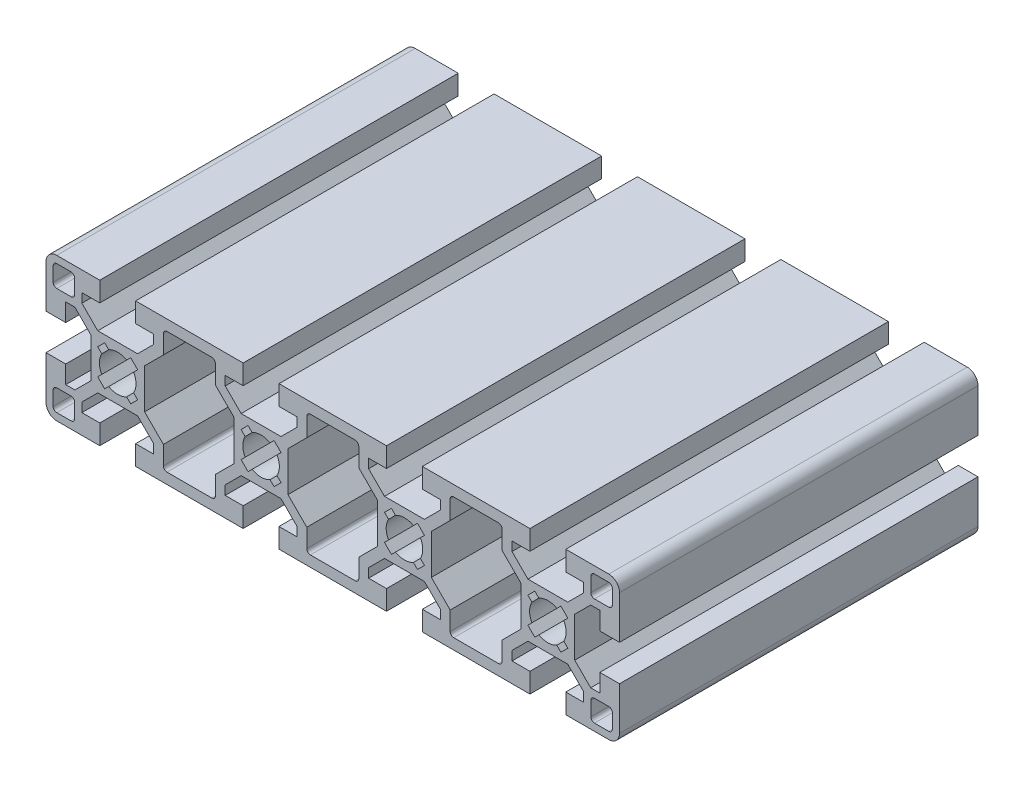
from build123d import *

# Parameters (mm, degrees)
BOSS_EXTRUDE1_DEPTH = 50


with BuildPart() as part:
    # Sketch1 → Boss-Extrude1 (new, symmetric)
    with BuildSketch(Plane.XY):
        with BuildLine():
            Line((-15, -20), (15, -20))
            Line((15, -20), (15, -14.5))
            Line((15, -14.5), (10, -14.5))
            Line((10, -14.5), (10, -11.944543648))
            Line((10, -11.944543648), (14.444543648, -7.5))
            Line((14.444543648, -7.5), (25.555456352, -7.5))
            Line((25.555456352, -7.5), (30, -11.944543648))
            Line((30, -11.944543648), (30, -14.5))
            Line((30, -14.5), (25, -14.5))
            Line((25, -14.5), (25, -20))
            Line((25, -20), (55, -20))
            Line((55, -20), (55, -14.5))
            Line((55, -14.5), (50, -14.5))
            Line((50, -14.5), (50, -11.944543648))
            Line((50, -11.944543648), (54.444543648, -7.5))
            Line((54.444543648, -7.5), (65.555456352, -7.5))
            Line((65.555456352, -7.5), (70, -11.944543648))
            Line((70, -11.944543648), (70, -14.5))
            Line((70, -14.5), (65, -14.5))
            Line((65, -14.5), (65, -20))
            Line((65, -20), (77, -20))
            ThreePointArc((77, -20), (79.121320344, -19.121320344), (80, -17))
            Line((80, -17), (80, -5))
            Line((80, -5), (74.5, -5))
            Line((74.5, -5), (74.5, -10))
            Line((74.5, -10), (71.944543648, -10))
            Line((71.944543648, -10), (67.5, -5.555456352))
            Line((67.5, -5.555456352), (67.5, 5.555456352))
            Line((67.5, 5.555456352), (71.944543648, 10))
            Line((71.944543648, 10), (74.5, 10))
            Line((74.5, 10), (74.5, 5))
            Line((74.5, 5), (80, 5))
            Line((80, 5), (80, 17))
            ThreePointArc((80, 17), (79.121320344, 19.121320344), (77, 20))
            Line((77, 20), (65, 20))
            Line((65, 20), (65, 14.5))
            Line((65, 14.5), (70, 14.5))
            Line((70, 14.5), (70, 11.944543648))
            Line((70, 11.944543648), (65.555456352, 7.5))
            Line((65.555456352, 7.5), (54.444543648, 7.5))
            Line((54.444543648, 7.5), (50, 11.944543648))
            Line((50, 11.944543648), (50, 14.5))
            Line((50, 14.5), (55, 14.5))
            Line((55, 14.5), (55, 20))
            Line((55, 20), (25, 20))
            Line((25, 20), (25, 14.5))
            Line((25, 14.5), (30, 14.5))
            Line((30, 14.5), (30, 11.944543648))
            Line((30, 11.944543648), (25.555456352, 7.5))
            Line((25.555456352, 7.5), (14.444543648, 7.5))
            Line((14.444543648, 7.5), (10, 11.944543648))
            Line((10, 11.944543648), (10, 14.5))
            Line((10, 14.5), (15, 14.5))
            Line((15, 14.5), (15, 20))
            Line((15, 20), (-15, 20))
            Line((-15, 20), (-15, 14.5))
            Line((-15, 14.5), (-10, 14.5))
            Line((-10, 14.5), (-10, 11.944543648))
            Line((-10, 11.944543648), (-14.444543648, 7.5))
            Line((-14.444543648, 7.5), (-25.555456352, 7.5))
            Line((-25.555456352, 7.5), (-30, 11.944543648))
            Line((-30, 11.944543648), (-30, 14.5))
            Line((-30, 14.5), (-25, 14.5))
            Line((-25, 14.5), (-25, 20))
            Line((-25, 20), (-55, 20))
            Line((-55, 20), (-55, 14.5))
            Line((-55, 14.5), (-50, 14.5))
            Line((-50, 14.5), (-50, 11.944543648))
            Line((-50, 11.944543648), (-54.444543648, 7.5))
            Line((-54.444543648, 7.5), (-65.555456352, 7.5))
            Line((-65.555456352, 7.5), (-70, 11.944543648))
            Line((-70, 11.944543648), (-70, 14.5))
            Line((-70, 14.5), (-65, 14.5))
            Line((-65, 14.5), (-65, 20))
            Line((-65, 20), (-77, 20))
            ThreePointArc((-77, 20), (-79.121320344, 19.121320344), (-80, 17))
            Line((-80, 17), (-80, 5))
            Line((-80, 5), (-74.5, 5))
            Line((-74.5, 5), (-74.5, 10))
            Line((-74.5, 10), (-71.944543648, 10))
            Line((-71.944543648, 10), (-67.5, 5.555456352))
            Line((-67.5, 5.555456352), (-67.5, -5.555456352))
            Line((-67.5, -5.555456352), (-71.944543648, -10))
            Line((-71.944543648, -10), (-74.5, -10))
            Line((-74.5, -10), (-74.5, -5))
            Line((-74.5, -5), (-80, -5))
            Line((-80, -5), (-80, -17))
            ThreePointArc((-80, -17), (-79.121320344, -19.121320344), (-77, -20))
            Line((-77, -20), (-65, -20))
            Line((-65, -20), (-65, -14.5))
            Line((-65, -14.5), (-70, -14.5))
            Line((-70, -14.5), (-70, -11.944543648))
            Line((-70, -11.944543648), (-65.555456352, -7.5))
            Line((-65.555456352, -7.5), (-54.444543648, -7.5))
            Line((-54.444543648, -7.5), (-50, -11.944543648))
            Line((-50, -11.944543648), (-50, -14.5))
            Line((-50, -14.5), (-55, -14.5))
            Line((-55, -14.5), (-55, -20))
            Line((-55, -20), (-25, -20))
            Line((-25, -20), (-25, -14.5))
            Line((-25, -14.5), (-30, -14.5))
            Line((-30, -14.5), (-30, -11.944543648))
            Line((-30, -11.944543648), (-25.555456352, -7.5))
            Line((-25.555456352, -7.5), (-14.444543648, -7.5))
            Line((-14.444543648, -7.5), (-10, -11.944543648))
            Line((-10, -11.944543648), (-10, -14.5))
            Line((-10, -14.5), (-15, -14.5))
            Line((-15, -14.5), (-15, -20))
        make_face()
        with BuildLine():
            Line((-78, 13), (-78, 17))
            ThreePointArc((-78, 17), (-77.707106781, 17.707106781), (-77, 18))
            Line((-77, 18), (-73, 18))
            ThreePointArc((-73, 18), (-72.292893219, 17.707106781), (-72, 17))
            Line((-72, 17), (-72, 13))
            ThreePointArc((-72, 13), (-72.292893219, 12.292893219), (-73, 12))
            Line((-73, 12), (-77, 12))
            ThreePointArc((-77, 12), (-77.707106781, 12.292893219), (-78, 13))
        make_face(mode=Mode.SUBTRACT)
        with BuildLine():
            Line((-55.555022098, -2.500434253), (-54.423651249, -3.631805103))
            Line((-54.423651249, -3.631805103), (-56.368194897, -5.576348751))
            Line((-56.368194897, -5.576348751), (-57.499565747, -4.444977902))
            ThreePointArc((-57.499565747, -4.444977902), (-60, -5.1), (-62.500434253, -4.444977902))
            Line((-62.500434253, -4.444977902), (-63.631805103, -5.576348751))
            Line((-63.631805103, -5.576348751), (-65.576348751, -3.631805103))
            Line((-65.576348751, -3.631805103), (-64.444977902, -2.500434253))
            ThreePointArc((-64.444977902, -2.500434253), (-65.1, 0), (-64.444977902, 2.500434253))
            Line((-64.444977902, 2.500434253), (-65.576348751, 3.631805103))
            Line((-65.576348751, 3.631805103), (-63.631805103, 5.576348751))
            Line((-63.631805103, 5.576348751), (-62.500434253, 4.444977902))
            ThreePointArc((-62.500434253, 4.444977902), (-60, 5.1), (-57.499565747, 4.444977902))
            Line((-57.499565747, 4.444977902), (-56.368194897, 5.576348751))
            Line((-56.368194897, 5.576348751), (-54.423651249, 3.631805103))
            Line((-54.423651249, 3.631805103), (-55.555022098, 2.500434253))
            ThreePointArc((-55.555022098, 2.500434253), (-54.9, 0), (-55.555022098, -2.500434253))
        make_face(mode=Mode.SUBTRACT)
        with BuildLine():
            Line((-78, -17), (-78, -13))
            ThreePointArc((-78, -13), (-77.707106781, -12.292893219), (-77, -12))
            Line((-77, -12), (-73, -12))
            ThreePointArc((-73, -12), (-72.292893219, -12.292893219), (-72, -13))
            Line((-72, -13), (-72, -17))
            ThreePointArc((-72, -17), (-72.292893219, -17.707106781), (-73, -18))
            Line((-73, -18), (-77, -18))
            ThreePointArc((-77, -18), (-77.707106781, -17.707106781), (-78, -17))
        make_face(mode=Mode.SUBTRACT)
        with BuildLine():
            Line((-27.5, 5.555456352), (-27.5, -5.555456352))
            Line((-27.5, -5.555456352), (-32.75, -10.805456352))
            Line((-32.75, -10.805456352), (-32.75, -16))
            ThreePointArc((-32.75, -16), (-33.042893219, -16.707106781), (-33.75, -17))
            Line((-33.75, -17), (-46.25, -17))
            ThreePointArc((-46.25, -17), (-46.957106781, -16.707106781), (-47.25, -16))
            Line((-47.25, -16), (-47.25, -10.805456352))
            Line((-47.25, -10.805456352), (-52.5, -5.555456352))
            Line((-52.5, -5.555456352), (-52.5, 5.555456352))
            Line((-52.5, 5.555456352), (-47.25, 10.805456352))
            Line((-47.25, 10.805456352), (-47.25, 16))
            ThreePointArc((-47.25, 16), (-46.957106781, 16.707106781), (-46.25, 17))
            Line((-46.25, 17), (-33.75, 17))
            ThreePointArc((-33.75, 17), (-33.042893219, 16.707106781), (-32.75, 16))
            Line((-32.75, 16), (-32.75, 10.805456352))
            Line((-32.75, 10.805456352), (-27.5, 5.555456352))
        make_face(mode=Mode.SUBTRACT)
        with BuildLine():
            Line((-15.555022098, -2.500434253), (-14.423651249, -3.631805103))
            Line((-14.423651249, -3.631805103), (-16.368194897, -5.576348751))
            Line((-16.368194897, -5.576348751), (-17.499565747, -4.444977902))
            ThreePointArc((-17.499565747, -4.444977902), (-20, -5.1), (-22.500434253, -4.444977902))
            Line((-22.500434253, -4.444977902), (-23.631805103, -5.576348751))
            Line((-23.631805103, -5.576348751), (-25.576348751, -3.631805103))
            Line((-25.576348751, -3.631805103), (-24.444977902, -2.500434253))
            ThreePointArc((-24.444977902, -2.500434253), (-25.1, 0), (-24.444977902, 2.500434253))
            Line((-24.444977902, 2.500434253), (-25.576348751, 3.631805103))
            Line((-25.576348751, 3.631805103), (-23.631805103, 5.576348751))
            Line((-23.631805103, 5.576348751), (-22.500434253, 4.444977902))
            ThreePointArc((-22.500434253, 4.444977902), (-20, 5.1), (-17.499565747, 4.444977902))
            Line((-17.499565747, 4.444977902), (-16.368194897, 5.576348751))
            Line((-16.368194897, 5.576348751), (-14.423651249, 3.631805103))
            Line((-14.423651249, 3.631805103), (-15.555022098, 2.500434253))
            ThreePointArc((-15.555022098, 2.500434253), (-14.9, 0), (-15.555022098, -2.500434253))
        make_face(mode=Mode.SUBTRACT)
        with BuildLine():
            Line((15.555022098, 2.500434253), (14.423651249, 3.631805103))
            Line((14.423651249, 3.631805103), (16.368194897, 5.576348751))
            Line((16.368194897, 5.576348751), (17.499565747, 4.444977902))
            ThreePointArc((17.499565747, 4.444977902), (20, 5.1), (22.500434253, 4.444977902))
            Line((22.500434253, 4.444977902), (23.631805103, 5.576348751))
            Line((23.631805103, 5.576348751), (25.576348751, 3.631805103))
            Line((25.576348751, 3.631805103), (24.444977902, 2.500434253))
            ThreePointArc((24.444977902, 2.500434253), (25.1, 0), (24.444977902, -2.500434253))
            Line((24.444977902, -2.500434253), (25.576348751, -3.631805103))
            Line((25.576348751, -3.631805103), (23.631805103, -5.576348751))
            Line((23.631805103, -5.576348751), (22.500434253, -4.444977902))
            ThreePointArc((22.500434253, -4.444977902), (20, -5.1), (17.499565747, -4.444977902))
            Line((17.499565747, -4.444977902), (16.368194897, -5.576348751))
            Line((16.368194897, -5.576348751), (14.423651249, -3.631805103))
            Line((14.423651249, -3.631805103), (15.555022098, -2.500434253))
            ThreePointArc((15.555022098, -2.500434253), (14.9, 0), (15.555022098, 2.500434253))
        make_face(mode=Mode.SUBTRACT)
        with BuildLine():
            Line((27.5, -5.555456352), (27.5, 5.555456352))
            Line((27.5, 5.555456352), (32.75, 10.805456352))
            Line((32.75, 10.805456352), (32.75, 16))
            ThreePointArc((32.75, 16), (33.042893219, 16.707106781), (33.75, 17))
            Line((33.75, 17), (46.25, 17))
            ThreePointArc((46.25, 17), (46.957106781, 16.707106781), (47.25, 16))
            Line((47.25, 16), (47.25, 10.805456352))
            Line((47.25, 10.805456352), (52.5, 5.555456352))
            Line((52.5, 5.555456352), (52.5, -5.555456352))
            Line((52.5, -5.555456352), (47.25, -10.805456352))
            Line((47.25, -10.805456352), (47.25, -16))
            ThreePointArc((47.25, -16), (46.957106781, -16.707106781), (46.25, -17))
            Line((46.25, -17), (33.75, -17))
            ThreePointArc((33.75, -17), (33.042893219, -16.707106781), (32.75, -16))
            Line((32.75, -16), (32.75, -10.805456352))
            Line((32.75, -10.805456352), (27.5, -5.555456352))
        make_face(mode=Mode.SUBTRACT)
        with BuildLine():
            Line((78, -13), (78, -17))
            ThreePointArc((78, -17), (77.707106781, -17.707106781), (77, -18))
            Line((77, -18), (73, -18))
            ThreePointArc((73, -18), (72.292893219, -17.707106781), (72, -17))
            Line((72, -17), (72, -13))
            ThreePointArc((72, -13), (72.292893219, -12.292893219), (73, -12))
            Line((73, -12), (77, -12))
            ThreePointArc((77, -12), (77.707106781, -12.292893219), (78, -13))
        make_face(mode=Mode.SUBTRACT)
        with BuildLine():
            Line((55.555022098, 2.500434253), (54.423651249, 3.631805103))
            Line((54.423651249, 3.631805103), (56.368194897, 5.576348751))
            Line((56.368194897, 5.576348751), (57.499565747, 4.444977902))
            ThreePointArc((57.499565747, 4.444977902), (60, 5.1), (62.500434253, 4.444977902))
            Line((62.500434253, 4.444977902), (63.631805103, 5.576348751))
            Line((63.631805103, 5.576348751), (65.576348751, 3.631805103))
            Line((65.576348751, 3.631805103), (64.444977902, 2.500434253))
            ThreePointArc((64.444977902, 2.500434253), (65.1, 0), (64.444977902, -2.500434253))
            Line((64.444977902, -2.500434253), (65.576348751, -3.631805103))
            Line((65.576348751, -3.631805103), (63.631805103, -5.576348751))
            Line((63.631805103, -5.576348751), (62.500434253, -4.444977902))
            ThreePointArc((62.500434253, -4.444977902), (60, -5.1), (57.499565747, -4.444977902))
            Line((57.499565747, -4.444977902), (56.368194897, -5.576348751))
            Line((56.368194897, -5.576348751), (54.423651249, -3.631805103))
            Line((54.423651249, -3.631805103), (55.555022098, -2.500434253))
            ThreePointArc((55.555022098, -2.500434253), (54.9, 0), (55.555022098, 2.500434253))
        make_face(mode=Mode.SUBTRACT)
        with BuildLine():
            Line((78, 17), (78, 13))
            ThreePointArc((78, 13), (77.707106781, 12.292893219), (77, 12))
            Line((77, 12), (73, 12))
            ThreePointArc((73, 12), (72.292893219, 12.292893219), (72, 13))
            Line((72, 13), (72, 17))
            ThreePointArc((72, 17), (72.292893219, 17.707106781), (73, 18))
            Line((73, 18), (77, 18))
            ThreePointArc((77, 18), (77.707106781, 17.707106781), (78, 17))
        make_face(mode=Mode.SUBTRACT)
        with BuildLine():
            Line((6.25, -17), (-6.25, -17))
            ThreePointArc((-6.25, -17), (-6.957106781, -16.707106781), (-7.25, -16))
            Line((-7.25, -16), (-7.25, -10.805456352))
            Line((-7.25, -10.805456352), (-12.5, -5.555456352))
            Line((-12.5, -5.555456352), (-12.5, 5.555456352))
            Line((-12.5, 5.555456352), (-7.25, 10.805456352))
            Line((-7.25, 10.805456352), (-7.25, 16))
            ThreePointArc((-7.25, 16), (-6.957106781, 16.707106781), (-6.25, 17))
            Line((-6.25, 17), (6.25, 17))
            ThreePointArc((6.25, 17), (6.957106781, 16.707106781), (7.25, 16))
            Line((7.25, 16), (7.25, 10.805456352))
            Line((7.25, 10.805456352), (12.5, 5.555456352))
            Line((12.5, 5.555456352), (12.5, -5.555456352))
            Line((12.5, -5.555456352), (7.25, -10.805456352))
            Line((7.25, -10.805456352), (7.25, -16))
            ThreePointArc((7.25, -16), (6.957106781, -16.707106781), (6.25, -17))
        make_face(mode=Mode.SUBTRACT)
    extrude(amount=BOSS_EXTRUDE1_DEPTH, both=True)


solid = part.part
